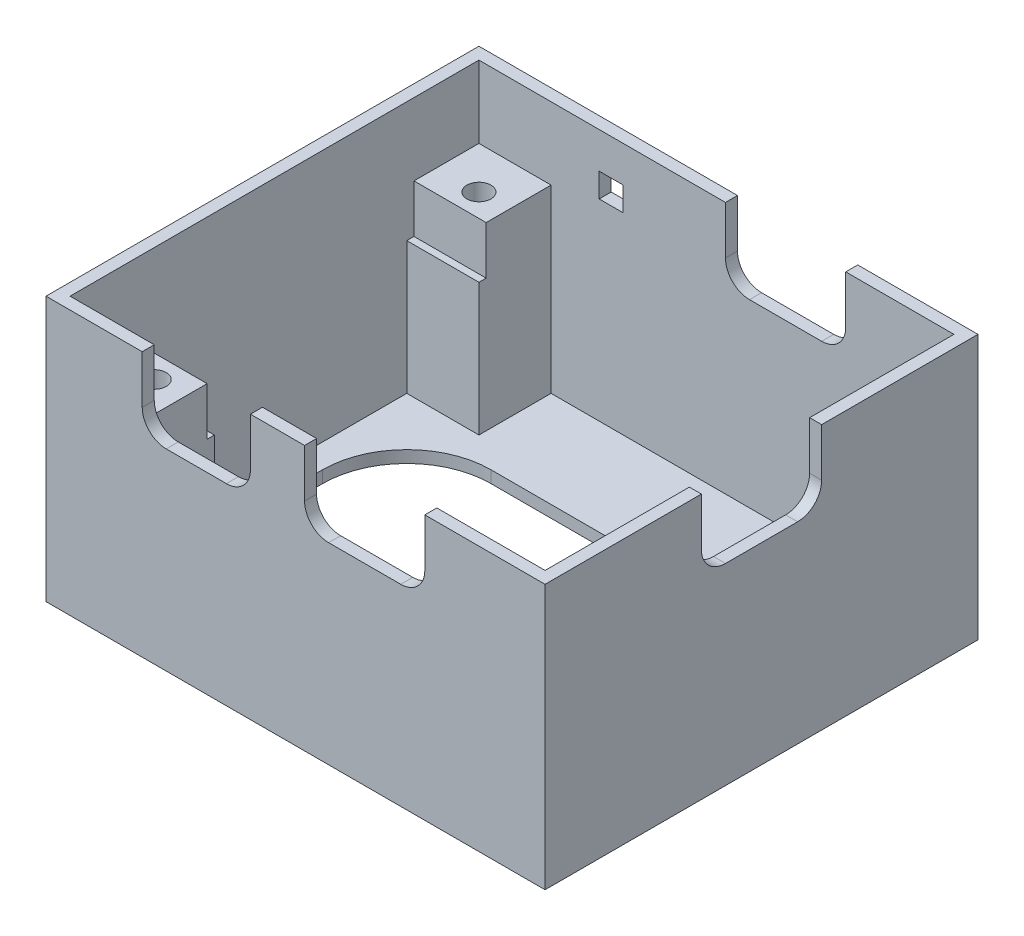
from build123d import *

# Parameters (mm, degrees)
SKETCH1_W             = 6
SKETCH1_H             = 6
SKETCH1_R             = 1
BOSS_EXTRUDE1_DEPTH   = 15
BOSS_EXTRUDE1_2_DEPTH = 15
BOSS_EXTRUDE1_3_DEPTH = 15
BOSS_EXTRUDE1_4_DEPTH = 15
SKETCH2_W             = 39.5
SKETCH2_H             = 33.999999999
BOSS_EXTRUDE2_DEPTH   = 1
SKETCH3_W             = 39.5
SKETCH3_H             = 33.999999999
BOSS_EXTRUDE3_DEPTH   = 22
SKETCH4_W             = 37.5
SKETCH4_H             = 17.999999999
CUT_EXTRUDE1_DEPTH    = 22
FILLET1_R             = 7
SKETCH7_W             = 6
SKETCH7_H             = 0.6
CUT_EXTRUDE2_DEPTH    = 4
SKETCH8_W             = 9.999999999
SKETCH8_H             = 6
CUT_EXTRUDE3_DEPTH    = 4
FILLET2_R             = 2
SKETCH9_W             = 10
SKETCH9_H             = 6
SKETCH9_W_2           = 9
CUT_EXTRUDE4_DEPTH    = 4
FILLET3_R             = 2
SKETCH10_W            = 10
SKETCH10_H            = 6
CUT_EXTRUDE5_DEPTH    = 4
FILLET4_R             = 2
SKETCH11_W            = 2
SKETCH11_H            = 2
CUT_EXTRUDE6_DEPTH    = 4


with BuildPart() as part:
    # Sketch1 → Boss-Extrude1 (new body)
    with BuildSketch(Plane(origin=(0, 0, 0), x_dir=(1, 0, 0), z_dir=(0, 1, 0))):
        with Locations((-7.839776389, 20.365683815)):
            Rectangle(SKETCH1_W, SKETCH1_H)
        with Locations(Location((-7.339776389, 19.865683815, 0), (0, 0, 270))):
            Circle(SKETCH1_R, mode=Mode.SUBTRACT)
    extrude(amount=BOSS_EXTRUDE1_DEPTH)



with BuildPart() as body_2:
    # Sketch1 → Boss-Extrude1 2 (new body)
    with BuildSketch(Plane(origin=(0, 0, 0), x_dir=(1, 0, 0), z_dir=(0, 1, 0))):
        with Locations((25.660223611, 20.365683814)):
            Rectangle(SKETCH1_W, SKETCH1_H)
        with Locations(Location((25.160223611, 19.865683814, 0), (0, 0, 270))):
            Circle(SKETCH1_R, mode=Mode.SUBTRACT)
    extrude(amount=BOSS_EXTRUDE1_2_DEPTH)


with BuildPart() as body_3:
    # Sketch1 → Boss-Extrude1 3 (new body)
    with BuildSketch(Plane(origin=(0, 0, 0), x_dir=(1, 0, 0), z_dir=(0, 1, 0))):
        with Locations((-7.839776389, -7.634316185)):
            Rectangle(SKETCH1_W, SKETCH1_H)
        with Locations(Location((-7.339776389, -7.134316185, 0), (0, 0, 270))):
            Circle(SKETCH1_R, mode=Mode.SUBTRACT)
    extrude(amount=BOSS_EXTRUDE1_3_DEPTH)


with BuildPart() as body_4:
    # Sketch1 → Boss-Extrude1 4 (new body)
    with BuildSketch(Plane(origin=(0, 0, 0), x_dir=(1, 0, 0), z_dir=(0, 1, 0))):
        with Locations((25.660371549, -7.634316185)):
            Rectangle(SKETCH1_W, SKETCH1_H)
        with Locations(Location((25.160371549, -7.134316185, 0), (0, 0, 270))):
            Circle(SKETCH1_R, mode=Mode.SUBTRACT)
    extrude(amount=BOSS_EXTRUDE1_4_DEPTH)


with BuildPart() as part_1:
    add(part.part)

    add(body_2.part)  # Boss-Extrude2 merges body 2

    add(body_3.part)  # Boss-Extrude2 merges body 3

    add(body_4.part)  # Boss-Extrude2 merges body 4
    # Sketch2 → Boss-Extrude2 (add)
    with BuildSketch(Plane.XZ):
        with Locations((8.910223611, -6.365683814)):
            Rectangle(SKETCH2_W, SKETCH2_H)
    extrude(amount=BOSS_EXTRUDE2_DEPTH)

    # Sketch3 → Boss-Extrude3 (add)
    with BuildSketch(Plane.XZ.offset(1)):
        Polygon((-11.839776389, 9.730248223), (-11.839776389, 11.634316185), (29.660223611, 11.634316185), (29.660223611, 9.730248223), (29.660223611, -24.365683814), (28.803720569, -24.365683814), (-10.696279431, -24.365683814), (-11.839776389, -24.365683814), align=None)
        with Locations((8.910223611, -6.365683814)):
            Rectangle(SKETCH3_W, SKETCH3_H, mode=Mode.SUBTRACT)
    extrude(amount=-BOSS_EXTRUDE3_DEPTH)

    # Sketch4 → Cut-Extrude1 (cut)
    with BuildSketch(Plane(origin=(0, 0, 0), x_dir=(1, 0, 0), z_dir=(0, 1, 0))):
        with Locations((9.910223611, 6.365683815)):
            Rectangle(SKETCH4_W, SKETCH4_H)
    extrude(amount=-CUT_EXTRUDE1_DEPTH, mode=Mode.SUBTRACT)

    # Fillet1
    fillet1_edges = [part_1.edges().sort_by_distance(p)[0] for p in [
        (-8.839776389, -0.5, 2.634316185),
        (-8.839776389, -0.5, -15.365683814),
        (28.660223611, -0.5, -15.365683814),
        (28.660223611, -0.5, 2.634316185),
    ]]
    fillet(fillet1_edges, radius=FILLET1_R)

    # Sketch7 → Cut-Extrude2 (cut)
    with BuildSketch(Plane(origin=(0, 15, 0), x_dir=(1, 0, 0), z_dir=(0, 1, 0))):
        with Locations((-7.839776389, 17.665683815)):
            Rectangle(SKETCH7_W, SKETCH7_H)
        with Locations((-7.839776389, -4.934316185)):
            Rectangle(SKETCH7_W, SKETCH7_H)
    extrude(amount=-CUT_EXTRUDE2_DEPTH, mode=Mode.SUBTRACT)

    # Sketch8 → Cut-Extrude3 (cut)
    with BuildSketch(Plane.ZY.offset(-28.660223611)):
        with Locations((-6.365683815, 18)):
            Rectangle(SKETCH8_W, SKETCH8_H)
    extrude(amount=-CUT_EXTRUDE3_DEPTH, mode=Mode.SUBTRACT)

    # Fillet2
    fillet2_edges = [part_1.edges().sort_by_distance(p)[0] for p in [
        (29.160223611, 15, -11.365683814),
        (29.160223611, 15, -1.365683815),
    ]]
    fillet(fillet2_edges, radius=FILLET2_R)

    # Sketch9 → Cut-Extrude4 (cut)
    with BuildSketch(Plane(origin=(0, 0, 10.634316185), x_dir=(-1, 0, 0), z_dir=(0, 0, -1))):
        with Locations((-14.660371549, 18)):
            Rectangle(SKETCH9_W, SKETCH9_H)
        with Locations((-0.660223611, 18)):
            Rectangle(SKETCH9_W_2, SKETCH9_H)
    extrude(amount=-CUT_EXTRUDE4_DEPTH, mode=Mode.SUBTRACT)

    # Fillet3
    fillet3_edges = [part_1.edges().sort_by_distance(p)[0] for p in [
        (19.660371549, 15, 11.134316185),
        (9.660371549, 15, 11.134316185),
        (5.160223611, 15, 11.134316185),
        (-3.839776389, 15, 11.134316185),
    ]]
    fillet(fillet3_edges, radius=FILLET3_R)

    # Sketch10 → Cut-Extrude5 (cut)
    with BuildSketch(Plane.XY.offset(-23.365683814)):
        with Locations((14.660223611, 18)):
            Rectangle(SKETCH10_W, SKETCH10_H)
    extrude(amount=-CUT_EXTRUDE5_DEPTH, mode=Mode.SUBTRACT)

    # Fillet4
    fillet4_edges = [part_1.edges().sort_by_distance(p)[0] for p in [
        (19.660223611, 15, -23.865683814),
        (9.660223611, 15, -23.865683814),
    ]]
    fillet(fillet4_edges, radius=FILLET4_R)

    # Sketch11 → Cut-Extrude6 (cut)
    with BuildSketch(Plane.XY.offset(-23.365683814)):
        with Locations((0.160223611, 17)):
            Rectangle(SKETCH11_W, SKETCH11_H)
    extrude(amount=-CUT_EXTRUDE6_DEPTH, mode=Mode.SUBTRACT)


solid = part_1.part
